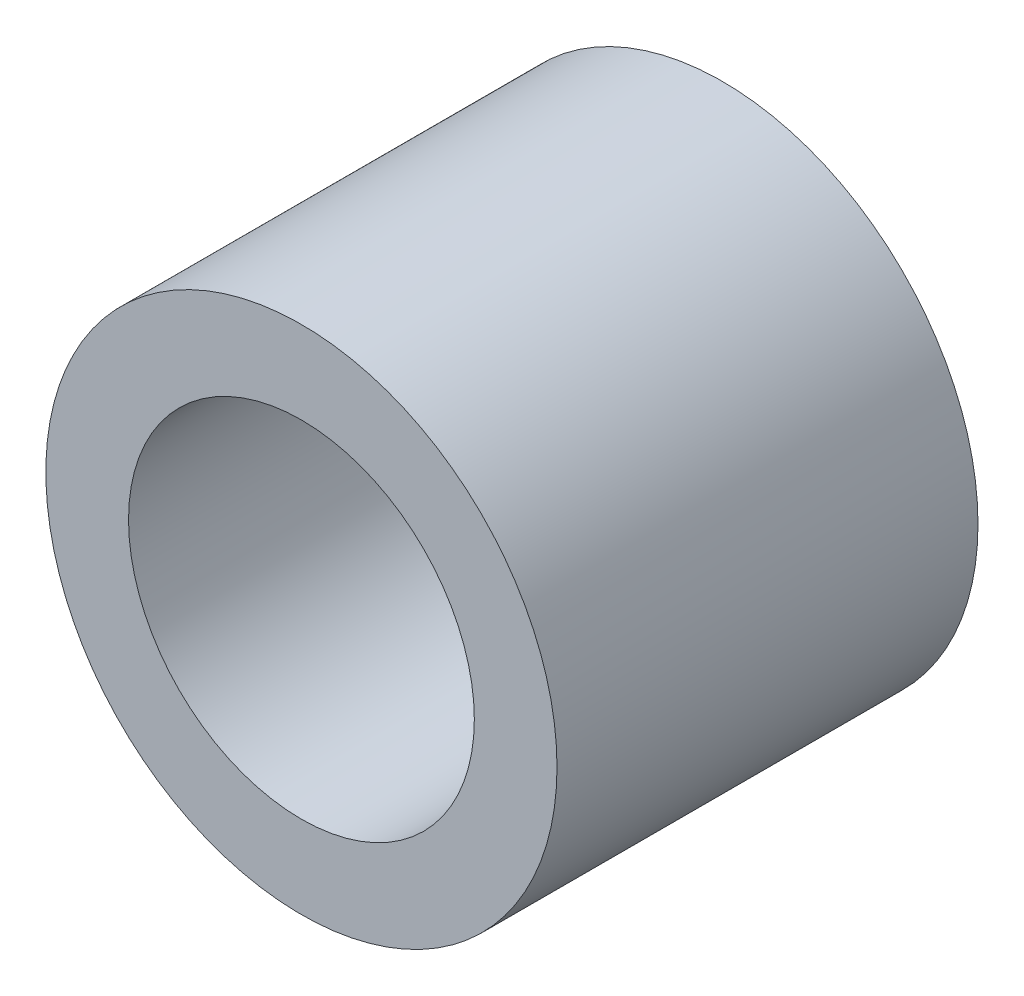
from build123d import *

# Parameters (mm, degrees)
ESQUISSE1_R        = 3.4
ESQUISSE1_R_2      = 2.3
BOSS_EXTRU_1_DEPTH = 2.8


with BuildPart() as part:
    # Esquisse1 → Boss.-Extru.1 (new, symmetric)
    with BuildSketch(Plane.XY):
        Circle(ESQUISSE1_R)
        Circle(ESQUISSE1_R_2, mode=Mode.SUBTRACT)
    extrude(amount=BOSS_EXTRU_1_DEPTH, both=True)


solid = part.part
